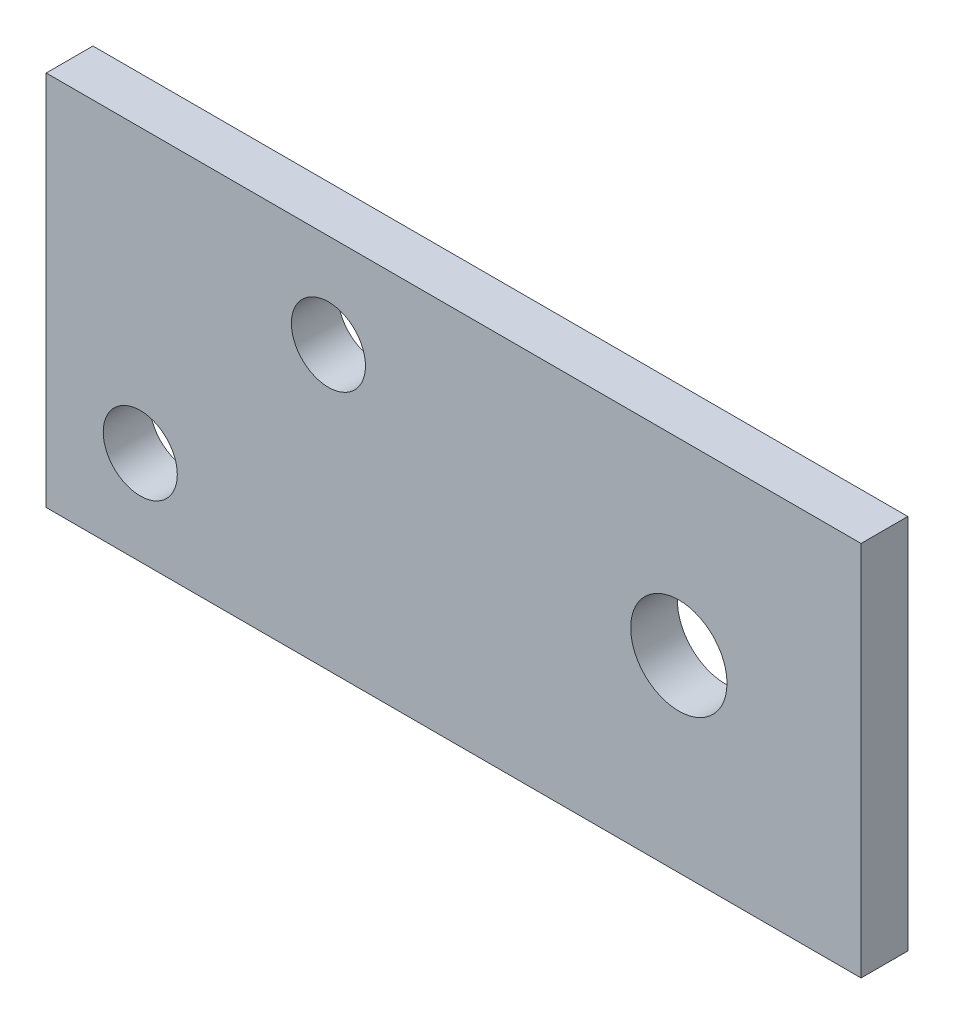
from build123d import *

# Parameters (mm, degrees)
CROQUIS1_R              = 6.501341754
SALIENTE_EXTRUIR1_DEPTH = 6.31
CROQUIS2_R              = 5
CORTAR_EXTRUIR1_DEPTH   = 10


with BuildPart() as part:
    # Croquis1 → Saliente-Extruir1 (new body)
    with BuildSketch(Plane.XY):
        Polygon((-59.2, 50.8), (-110, 50.8), (-110, 0), (0, 0), (0, 50.8), align=None)
        with Locations((-24.6, 25.401341754)):
            Circle(CROQUIS1_R, mode=Mode.SUBTRACT)
    extrude(amount=SALIENTE_EXTRUIR1_DEPTH)

    # Croquis2 → Cortar-Extruir1 (cut)
    with BuildSketch(Plane(origin=(0, 0, 0), x_dir=(-1, 0, 0), z_dir=(0, 0, -1))):
        with Locations((97.3, 12.7)):
            Circle(CROQUIS2_R)
        with Locations((71.9, 38.1)):
            Circle(CROQUIS2_R)
    extrude(amount=-CORTAR_EXTRUIR1_DEPTH, mode=Mode.SUBTRACT)


solid = part.part
